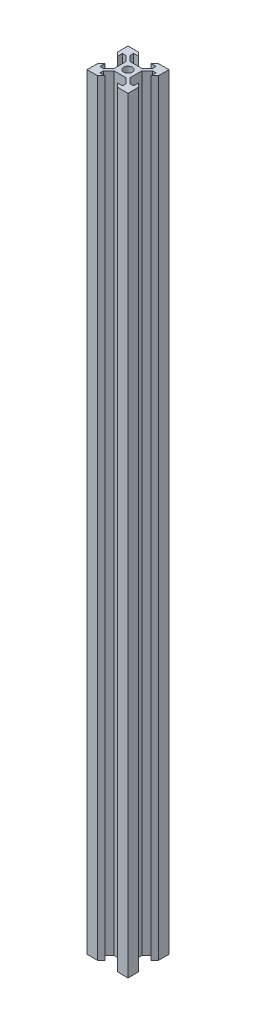
from build123d import *

# Parameters (mm, degrees)
SKETCH1_R           = 2.1
BOSS_EXTRUDE1_DEPTH = 374.16573868


with BuildPart() as part:
    # Sketch1 → Boss-Extrude1 (new body)
    with BuildSketch(Plane(origin=(0, 0, 0), x_dir=(1, 0, 0), z_dir=(0, 1, 0))):
        Polygon((-3.900660172, -2.84), (-3.900660172, 0), (-3.900660172, 2.84), (-6.56, 5.499339828), (-8.2, 5.499339828), (-8.2, 3.1), (-10, 4.9), (-10, 10), (-4.9, 10), (-3.1, 8.2), (-5.499339828, 8.2), (-5.499339828, 6.56), (-2.84, 3.900660172), (0, 3.900660172), (2.84, 3.900660172), (5.499339828, 6.56), (5.499339828, 8.2), (3.1, 8.2), (4.9, 10), (10, 10), (10, 4.9), (8.2, 3.1), (8.2, 5.499339828), (6.56, 5.499339828), (3.900660172, 2.84), (3.900660172, 0), (3.900660172, -2.84), (6.56, -5.499339828), (8.2, -5.499339828), (8.2, -3.1), (10, -4.9), (10, -10), (4.9, -10), (3.1, -8.2), (5.499339828, -8.2), (5.499339828, -6.56), (2.84, -3.900660172), (0, -3.900660172), (-2.84, -3.900660172), (-5.499339828, -6.56), (-5.499339828, -8.2), (-3.1, -8.2), (-4.9, -10), (-10, -10), (-10, -4.9), (-8.2, -3.1), (-8.2, -5.499339828), (-6.56, -5.499339828), align=None)
        with Locations(Location((0, 0, 0), (0, 0, 90))):
            Circle(SKETCH1_R, mode=Mode.SUBTRACT)
    extrude(amount=BOSS_EXTRUDE1_DEPTH)


solid = part.part
